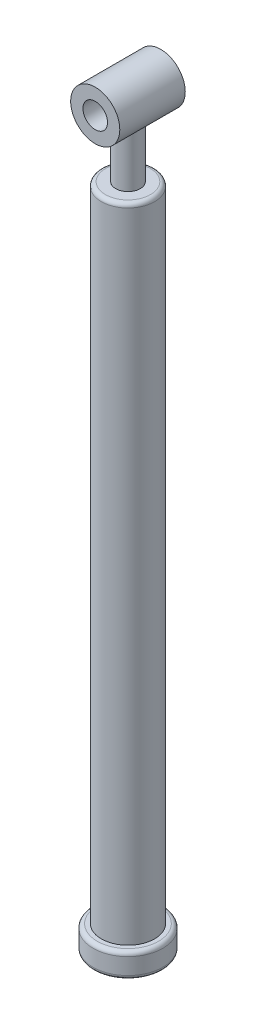
from build123d import *

# Parameters (mm, degrees)
SKETCH3_R                = 30
SKETCH3_R_2              = 15
BOSS_EXTRUDE2_DEPTH      = 40
BOSS_EXTRUDE3_REACH      = 819.213
BOSS_EXTRUDE3_END_RADIUS = 30
SKETCH4_R                = 15


with BuildPart() as part:
    # Sketch1 → Revolve1 (revolve)
    with BuildSketch(Plane.XY, mode=Mode.PRIVATE) as revolve1_sk:
        with BuildLine():
            Line((-19.9999, -125.557753903), (-37.5, -125.557753903))
            ThreePointArc((-37.5, -125.557753903), (-41.035533906, -124.093287809), (-42.5, -120.557753903))
            Line((-42.5, -120.557753903), (-42.5, -100.557753903))
            ThreePointArc((-42.5, -100.557753903), (-41.035533906, -97.022219997), (-37.5, -95.557753903))
            Line((-37.5, -95.557753903), (-32.5, -95.557753903))
            Line((-32.5, -95.557753903), (-32.5, 684.442246097))
            ThreePointArc((-32.5, 684.442246097), (-31.035563195, 687.977709292), (-27.5001, 689.442146097))
            Line((-27.5001, 689.442146097), (-15, 689.442146097))
            Line((-15, 689.442146097), (-15, -120.557853903))
            ThreePointArc((-15, -120.557853903), (-16.464436805, -124.093317098), (-19.9999, -125.557753903))
        make_face()
    revolve(revolve1_sk.sketch.rotate(Axis((0, 143.904834125, 0), (0, -1, 0)), 270), axis=Axis((0, 143.904834125, 0), (0, -1, 0)))


with BuildPart() as body_2:
    # Sketch3 → Boss-Extrude2 (new, symmetric)
    with BuildSketch(Plane.XY):
        with Locations((0, 779.442146097)):
            Circle(SKETCH3_R)
        with Locations((0, 779.442146097)):
            Circle(SKETCH3_R_2, mode=Mode.SUBTRACT)
    extrude(amount=BOSS_EXTRUDE2_DEPTH, both=True)

    # Boss-Extrude3: up to this cylinder (the profile starts outside it)
    boss_extrude3_end = Plane(origin=(0, 779.442146097, 0), z_dir=(0, 0, -1)) * Cylinder(BOSS_EXTRUDE3_END_RADIUS, 1699.426, mode=Mode.PRIVATE)
    # Sketch4 → Boss-Extrude3 (add, up to the surface)
    with BuildSketch(Plane(origin=(0, 689.442146097, 0), x_dir=(1, 0, 0), z_dir=(0, 1, 0)), mode=Mode.PRIVATE) as boss_extrude3_sk1:
        with Locations(Location((0, 0, 0), (0, 0, 90))):
            Circle(SKETCH4_R)
    boss_extrude3_tool1 = extrude(boss_extrude3_sk1.sketch, amount=BOSS_EXTRUDE3_REACH, mode=Mode.PRIVATE) - boss_extrude3_end
    add(boss_extrude3_tool1.solids().sort_by_distance((0, 689.442146, 0))[0])


solid = Compound([part.part, body_2.part])
